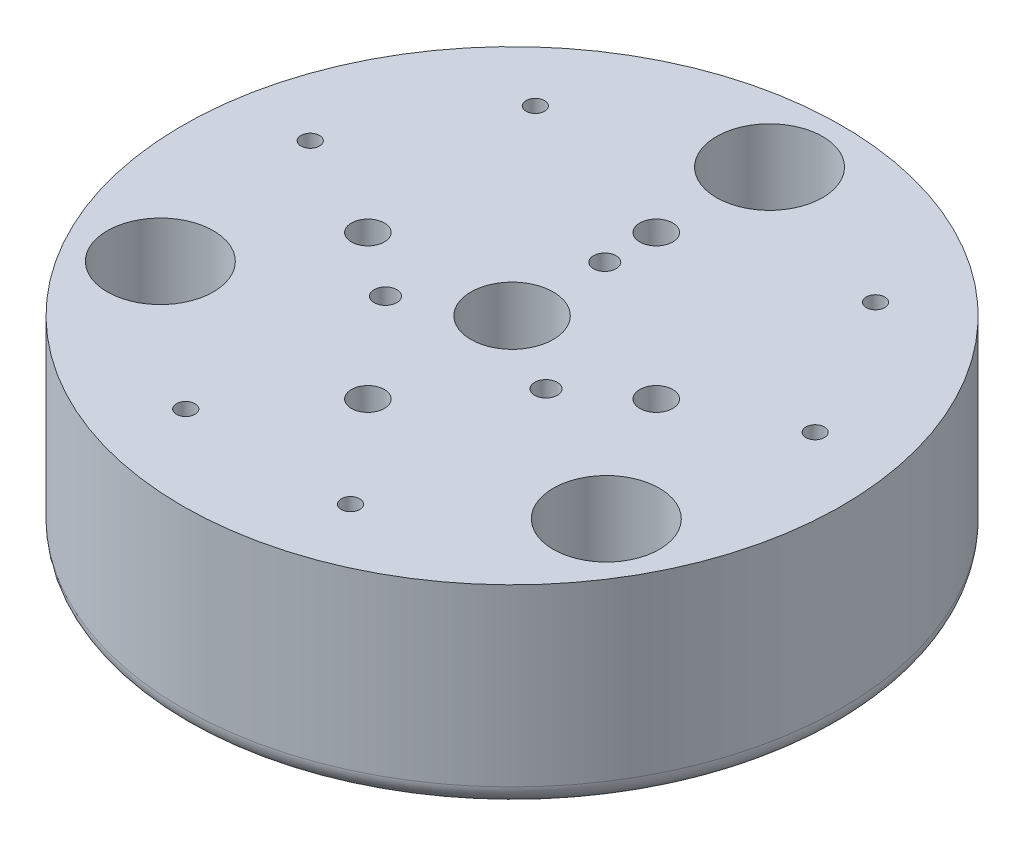
from build123d import *

# Parameters (mm, degrees)
SKETCH_1_R          = 32
SKETCH_1_R_2        = 4
SKETCH_1_R_3        = 3
EXTRUDE_1_DEPTH     = 19
FILLET_1_R          = 2
SKETCH_2_R          = 5.15
CUT_EXTRUDE_1_DEPTH = 15.2
SKETCH_3_R          = 2.55
CUT_EXTRUDE_2_DEPTH = 15
SKETCH_4_R          = 1.6
CUT_EXTRUDE_3_DEPTH = 50.081564832
SKETCH_5_R          = 1.1
CUT_EXTRUDE_4_DEPTH = 50.081564832
SKETCH_6_R          = 2.85
CUT_EXTRUDE_5_DEPTH = 8
SKETCH_7_R          = 1.8
CUT_EXTRUDE_6_DEPTH = 3
CHAMFER_1_SIZE      = 1
SKETCH_8_R          = 0.9
CUT_EXTRUDE_7_DEPTH = 50.081564832


with BuildPart() as part:
    # Эскиз1 → Бобышка-Вытянуть1 (new body)
    with BuildSketch(Plane(origin=(0, 0, 0), x_dir=(1, 0, 0), z_dir=(0, 1, 0))):
        with Locations(Location((0, 0, 0), (0, 0, 270))):
            Circle(SKETCH_1_R)
        with Locations(Location((0, 0, 0), (0, 0, 270))):
            Circle(SKETCH_1_R_2, mode=Mode.SUBTRACT)
        with Locations(Location((0, 25, 0), (0, 0, 270))):
            Circle(SKETCH_1_R_3, mode=Mode.SUBTRACT)
        with Locations(Location((21.650635095, -12.5, 0), (0, 0, 270))):
            Circle(SKETCH_1_R_3, mode=Mode.SUBTRACT)
        with Locations(Location((-21.650635095, -12.5, 0), (0, 0, 270))):
            Circle(SKETCH_1_R_3, mode=Mode.SUBTRACT)
    extrude(amount=EXTRUDE_1_DEPTH)

    # Скругление1
    fillet_1_edges = [part.edges().sort_by_distance(p)[0] for p in [
        (0, 0, -32),
    ]]
    fillet(fillet_1_edges, radius=FILLET_1_R)

    # Эскиз2 → Вырез-Вытянуть1 (cut)
    with BuildSketch(Plane(origin=(0, 19, 0), x_dir=(1, 0, 0), z_dir=(0, 1, 0))):
        with Locations(Location((0, 25, 0), (0, 0, 270))):
            Circle(SKETCH_2_R)
        with Locations(Location((21.650635095, -12.5, 0), (0, 0, 270))):
            Circle(SKETCH_2_R)
        with Locations(Location((-21.650635095, -12.5, 0), (0, 0, 270))):
            Circle(SKETCH_2_R)
    extrude(amount=-CUT_EXTRUDE_1_DEPTH, mode=Mode.SUBTRACT)

    # Эскиз3 → Вырез-Вытянуть2 (cut)
    with BuildSketch(Plane.XZ):
        with Locations(Location((0, 25, 0), (0, 0, 270))):
            Circle(SKETCH_3_R)
        with Locations(Location((21.650635095, -12.5, 0), (0, 0, 270))):
            Circle(SKETCH_3_R)
        with Locations(Location((-21.650635095, -12.5, 0), (0, 0, 270))):
            Circle(SKETCH_3_R)
    extrude(amount=-CUT_EXTRUDE_2_DEPTH, mode=Mode.SUBTRACT)

    # Эскиз4 → Вырез-Вытянуть3 (cut, through all)
    with BuildSketch(Plane.XZ):
        with Locations(Location((0, 14, 0), (0, 0, 270))):
            Circle(SKETCH_4_R)
        with Locations(Location((14, 0, 0), (0, 0, 270))):
            Circle(SKETCH_4_R)
        with Locations(Location((0, -14, 0), (0, 0, 270))):
            Circle(SKETCH_4_R)
        with Locations(Location((-14, 0, 0), (0, 0, 270))):
            Circle(SKETCH_4_R)
    extrude(amount=-CUT_EXTRUDE_3_DEPTH, mode=Mode.SUBTRACT)

    # Эскиз5 → Вырез-Вытянуть4 (cut, through all)
    with BuildSketch(Plane(origin=(0, 19, 0), x_dir=(1, 0, 0), z_dir=(0, 1, 0))):
        with Locations(Location((0, 9, 0), (0, 0, 270))):
            Circle(SKETCH_5_R)
        with Locations(Location((7.794228634, -4.5, 0), (0, 0, 270))):
            Circle(SKETCH_5_R)
        with Locations(Location((-7.794228634, -4.5, 0), (0, 0, 270))):
            Circle(SKETCH_5_R)
    extrude(amount=-CUT_EXTRUDE_4_DEPTH, mode=Mode.SUBTRACT)

    # Эскиз6 → Вырез-Вытянуть5 (cut)
    with BuildSketch(Plane.XZ):
        with Locations(Location((0, 14, 0), (0, 0, 270))):
            Circle(SKETCH_6_R)
        with Locations(Location((14, 0, 0), (0, 0, 270))):
            Circle(SKETCH_6_R)
        with Locations(Location((0, -14, 0), (0, 0, 270))):
            Circle(SKETCH_6_R)
        with Locations(Location((-14, 0, 0), (0, 0, 270))):
            Circle(SKETCH_6_R)
    extrude(amount=-CUT_EXTRUDE_5_DEPTH, mode=Mode.SUBTRACT)

    # Эскиз7 → Вырез-Вытянуть6 (cut)
    with BuildSketch(Plane.XZ):
        with Locations(Location((7.794228634, 4.5, 0), (0, 0, 270))):
            Circle(SKETCH_7_R)
        with Locations(Location((0, -9, 0), (0, 0, 270))):
            Circle(SKETCH_7_R)
        with Locations(Location((-7.794228634, 4.5, 0), (0, 0, 270))):
            Circle(SKETCH_7_R)
    extrude(amount=-CUT_EXTRUDE_6_DEPTH, mode=Mode.SUBTRACT)

    # Фаска1
    chamfer_1_edges = [part.edges().sort_by_distance(p)[0] for p in [
        (21.650635095, 0, 9.5),
        (-21.650635095, 0, 9.5),
        (0, 0, 27.55),
        (21.650635095, 0, -9.95),
        (-21.650635095, 0, -9.95),
        (0, 0, -4),
        (0, 0, -28),
    ]]
    chamfer(chamfer_1_edges, length=CHAMFER_1_SIZE)

    # Эскиз8 → Вырез-Вытянуть7 (cut, through all)
    with BuildSketch(Plane.XZ):
        with Locations(Location((-8, 23.685438565, 0), (0, 0, 270))):
            Circle(SKETCH_8_R)
        with Locations(Location((8, 23.685438565, 0), (0, 0, 270))):
            Circle(SKETCH_8_R)
        with Locations(Location((24.512191497, -4.914516052, 0), (0, 0, 270))):
            Circle(SKETCH_8_R)
        with Locations(Location((16.512191497, -18.770922513, 0), (0, 0, 270))):
            Circle(SKETCH_8_R)
        with Locations(Location((-16.512191497, -18.770922513, 0), (0, 0, 270))):
            Circle(SKETCH_8_R)
        with Locations(Location((-24.512191497, -4.914516052, 0), (0, 0, 270))):
            Circle(SKETCH_8_R)
    extrude(amount=-CUT_EXTRUDE_7_DEPTH, mode=Mode.SUBTRACT)


solid = part.part
